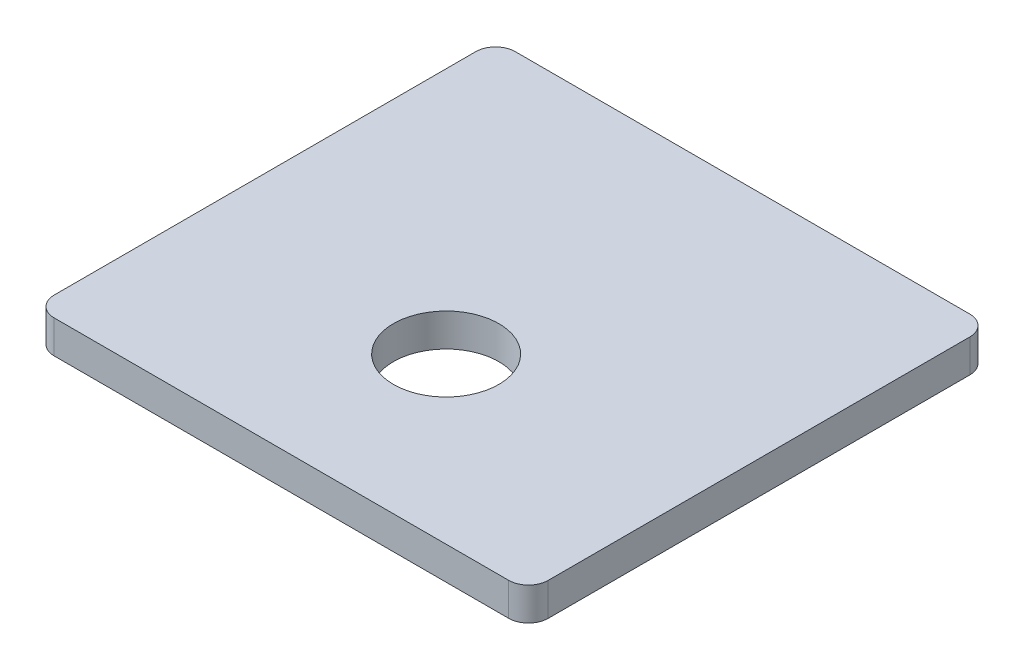
from build123d import *

# Parameters (mm, degrees)
SKETCH_1_W             = 75
SKETCH_1_H             = 5
BLOCKEXTRUDE_DEPTH     = 70
FILLET_2_R             = 3
SKETCH_2_R             = 8
ROTARY_SEAL_SEAT_DEPTH = 103.713192921


with BuildPart() as part:
    # 草图1 → BlockExtrude (new body)
    with BuildSketch(Plane.XY):
        with Locations((37.5, 2.5)):
            Rectangle(SKETCH_1_W, SKETCH_1_H)
    extrude(amount=BLOCKEXTRUDE_DEPTH)

    # Fillet 2
    fillet_2_edges = [part.edges().sort_by_distance(p)[0] for p in [
        (75, 2.5, 70),
        (0, 2.5, 70),
        (75, 2.5, 0),
        (0, 2.5, 0),
    ]]
    fillet(fillet_2_edges, radius=FILLET_2_R)

    # 草图2 → Rotary_seal_seat (cut, through all)
    with BuildSketch(Plane(origin=(0, 5, 0), x_dir=(1, 0, 0), z_dir=(0, 1, 0))):
        with Locations(Location((37.5, -45, 0), (0, 0, 270))):
            Circle(SKETCH_2_R)
    extrude(amount=-ROTARY_SEAL_SEAT_DEPTH, mode=Mode.SUBTRACT)


solid = part.part
